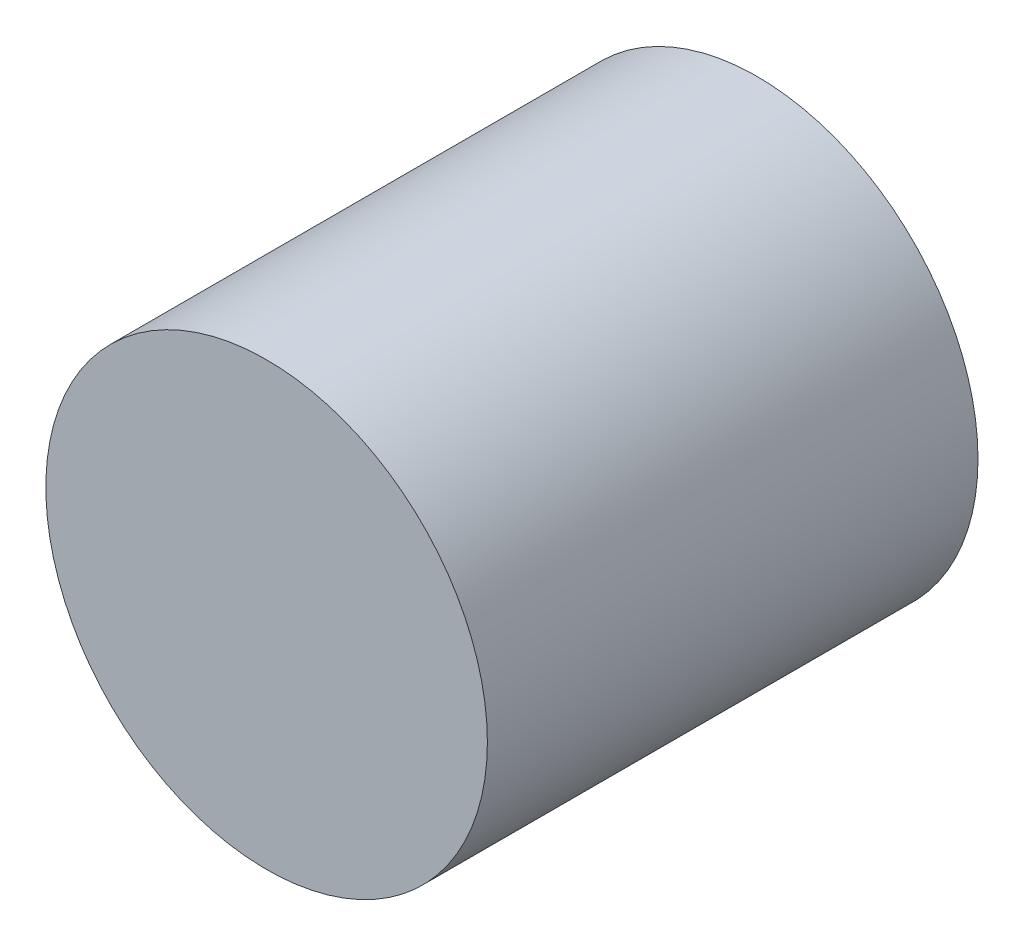
from build123d import *

# Parameters (mm, degrees)
SCHIZZO1_R                   = 54
ESTRUSIONE_ESTRUSIONE1_DEPTH = 120


with BuildPart() as part:
    # Schizzo1 → Estrusione-Estrusione1 (new body)
    with BuildSketch(Plane.XY):
        Circle(SCHIZZO1_R)
    extrude(amount=ESTRUSIONE_ESTRUSIONE1_DEPTH)


solid = part.part
